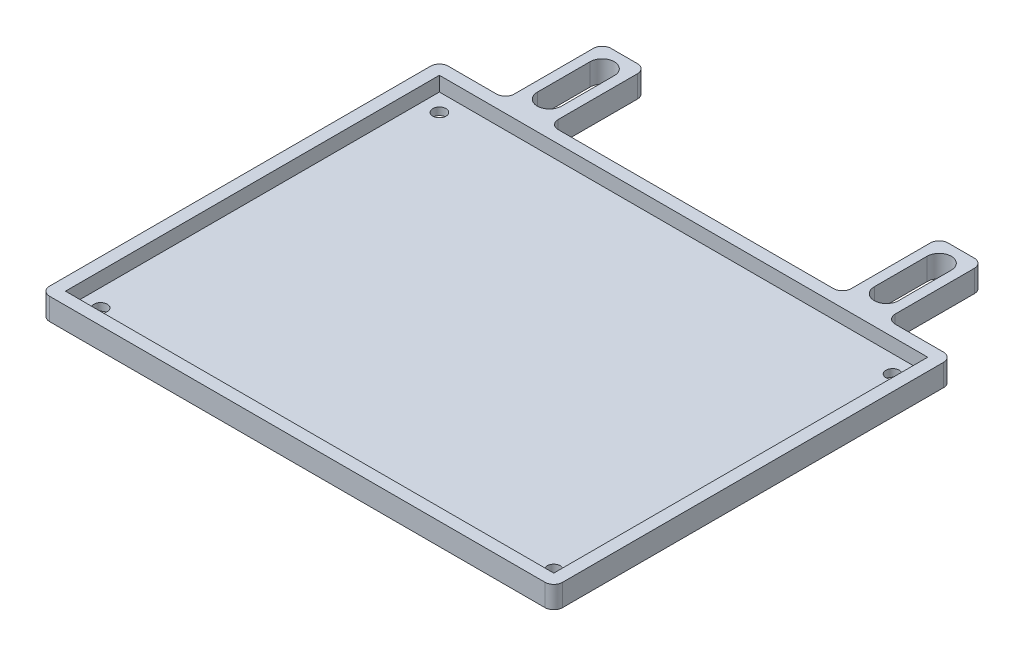
from build123d import *

# Parameters (mm, degrees)
EXTRUDE_1_DEPTH     = 5
SKETCH_4_R          = 1.5
CUT_EXTRUDE_4_DEPTH = 90.180603272
SKETCH_4_3_W        = 111
SKETCH_4_3_H        = 85
SKETCH_4_3_R        = 1.5
CUT_EXTRUDE_5_DEPTH = 3.3
FILLET_1_R          = 2


with BuildPart() as part:
    # 草图2 → 凸台-拉伸1 (new body)
    with BuildSketch(Plane(origin=(0, 0, 0), x_dir=(1, 0, 0), z_dir=(0, 1, 0))):
        Polygon((-43.3, 45.3), (-43.3, 67.3), (-33.3, 67.3), (-33.3, 45.3), (33.3, 45.3), (33.3, 67.3), (43.3, 67.3), (43.3, 45.3), (58.3, 45.3), (58.3, -45.3), (-58.3, -45.3), (-58.3, 45.3), align=None)
        with BuildLine():
            Line((-35.55, 62.3), (-35.55, 50.3))
            ThreePointArc((-35.55, 50.3), (-38.3, 47.55), (-41.05, 50.3))
            Line((-41.05, 50.3), (-41.05, 62.3))
            ThreePointArc((-41.05, 62.3), (-38.3, 65.05), (-35.55, 62.3))
        make_face(mode=Mode.SUBTRACT)
        with BuildLine():
            Line((35.55, 62.3), (35.55, 50.3))
            ThreePointArc((35.55, 50.3), (38.3, 47.55), (41.05, 50.3))
            Line((41.05, 50.3), (41.05, 62.3))
            ThreePointArc((41.05, 62.3), (38.3, 65.05), (35.55, 62.3))
        make_face(mode=Mode.SUBTRACT)
    extrude(amount=EXTRUDE_1_DEPTH)

    # 草图4 → 切除-拉伸4 (cut, through all)
    with BuildSketch(Plane(origin=(0, 5, 0), x_dir=(1, 0, 0), z_dir=(0, 1, 0))):
        with Locations((-51.5, 38.5)):
            Circle(SKETCH_4_R)
        with Locations((-51.5, -38.5)):
            Circle(SKETCH_4_R)
        with Locations((51.5, -38.5)):
            Circle(SKETCH_4_R)
        with Locations((51.5, 38.5)):
            Circle(SKETCH_4_R)
    extrude(amount=-CUT_EXTRUDE_4_DEPTH, mode=Mode.SUBTRACT)

    # 草图4<3> → 切除-拉伸5 (cut)
    with BuildSketch(Plane(origin=(0, 5, 0), x_dir=(1, 0, 0), z_dir=(0, 1, 0))):
        Rectangle(SKETCH_4_3_W, SKETCH_4_3_H)
        with Locations((-51.5, -38.5)):
            Circle(SKETCH_4_3_R, mode=Mode.SUBTRACT)
        with Locations((51.5, -38.5)):
            Circle(SKETCH_4_3_R, mode=Mode.SUBTRACT)
        with Locations((-51.5, 38.5)):
            Circle(SKETCH_4_3_R, mode=Mode.SUBTRACT)
        with Locations((51.5, 38.5)):
            Circle(SKETCH_4_3_R, mode=Mode.SUBTRACT)
    extrude(amount=-CUT_EXTRUDE_5_DEPTH, mode=Mode.SUBTRACT)

    # 圆角1
    fillet_1_edges = [part.edges().sort_by_distance(p)[0] for p in [
        (58.3, 2.5, 45.3),
        (-58.3, 2.5, 45.3),
        (-58.3, 2.5, -45.3),
        (-43.3, 2.5, -45.3),
        (-43.3, 2.5, -67.3),
        (-33.3, 2.5, -67.3),
        (-33.3, 2.5, -45.3),
        (33.3, 2.5, -45.3),
        (33.3, 2.5, -67.3),
        (43.3, 2.5, -67.3),
        (43.3, 2.5, -45.3),
        (58.3, 2.5, -45.3),
    ]]
    fillet(fillet_1_edges, radius=FILLET_1_R)


solid = part.part
